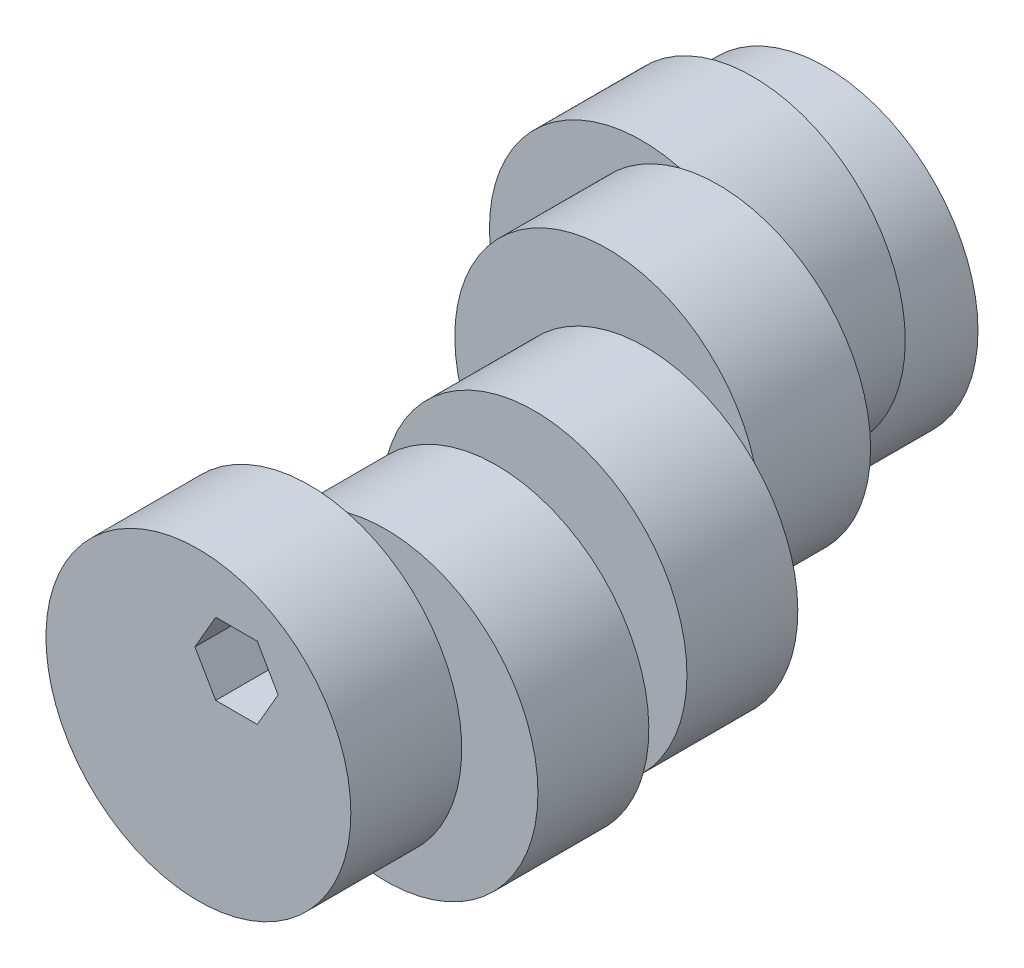
from build123d import *

# Parameters (mm, degrees)
SKETCH1_R           = 11
BOSS_EXTRUDE1_DEPTH = 8
SKETCH3_R           = 11
BOSS_EXTRUDE2_DEPTH = 8
SKETCH4_R           = 11
BOSS_EXTRUDE4_DEPTH = 8
SKETCH5_R           = 11
BOSS_EXTRUDE5_DEPTH = 8
SKETCH6_R           = 11
BOSS_EXTRUDE6_DEPTH = 8
SKETCH8_R           = 11
BOSS_EXTRUDE7_DEPTH = 8
CUT_EXTRUDE1_DEPTH  = 48


with BuildPart() as part:
    # Sketch1 → Boss-Extrude1 (new body)
    with BuildSketch(Plane.XY):
        Circle(SKETCH1_R)
    extrude(amount=BOSS_EXTRUDE1_DEPTH)

    # Sketch3 → Boss-Extrude2 (add)
    with BuildSketch(Plane.XY.offset(8)):
        with Locations(Location((2.75, 4.763139721, 0), (0, 0, 164.477512186))):
            Circle(SKETCH3_R)
    extrude(amount=BOSS_EXTRUDE2_DEPTH)

    # Sketch4 → Boss-Extrude4 (add)
    with BuildSketch(Plane.XY.offset(16)):
        with Locations(Location((8.25, 4.763139721, 0), (0, 0, 255.522487814))):
            Circle(SKETCH4_R)
    extrude(amount=BOSS_EXTRUDE4_DEPTH)

    # Sketch5 → Boss-Extrude5 (add)
    with BuildSketch(Plane.XY.offset(24)):
        with Locations(Location((11, 0, 0), (0, 0, 195.522487814))):
            Circle(SKETCH5_R)
    extrude(amount=BOSS_EXTRUDE5_DEPTH)

    # Sketch6 → Boss-Extrude6 (add)
    with BuildSketch(Plane.XY.offset(32)):
        with Locations(Location((8.25, -4.763139721, 0), (0, 0, 135.522487814))):
            Circle(SKETCH6_R)
    extrude(amount=BOSS_EXTRUDE6_DEPTH)

    # Sketch8 → Boss-Extrude7 (add)
    with BuildSketch(Plane.XY.offset(40)):
        with Locations(Location((2.75, -4.763139721, 0), (0, 0, 284.477512186))):
            Circle(SKETCH8_R)
    extrude(amount=BOSS_EXTRUDE7_DEPTH)

    # Sketch9 → Cut-Extrude1 (cut)
    with BuildSketch(Plane.XY.offset(48)):
        Polygon((8.5, 0), (7, 2.598076211), (4, 2.598076211), (2.5, 0), (4, -2.598076211), (7, -2.598076211), align=None)
    extrude(amount=-CUT_EXTRUDE1_DEPTH, mode=Mode.SUBTRACT)


solid = part.part
